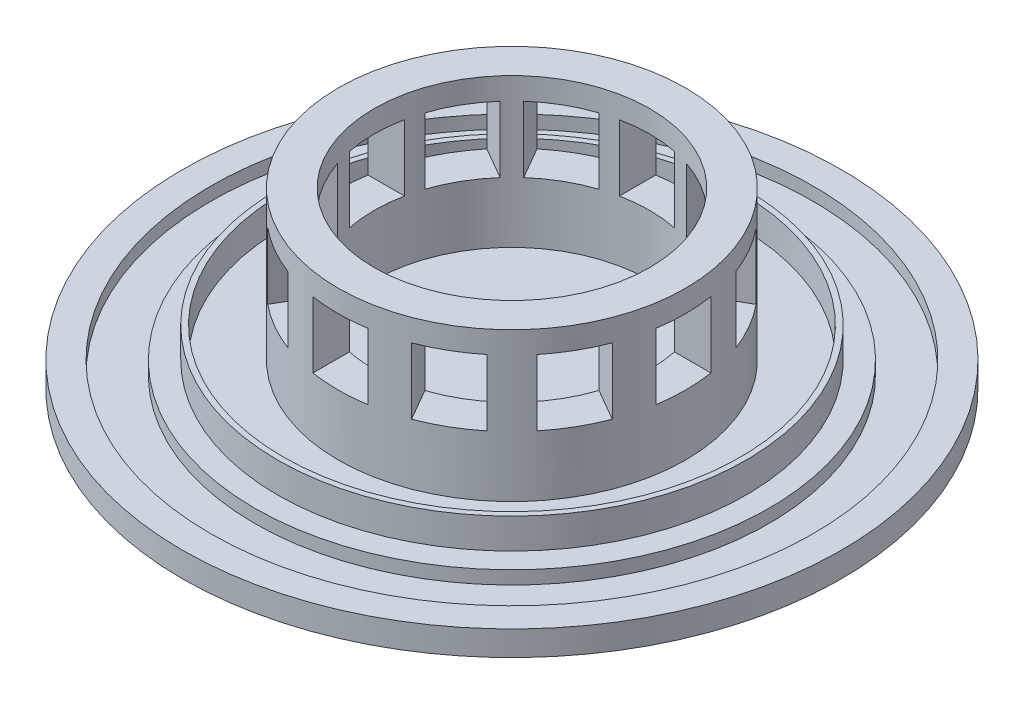
from build123d import *

# Parameters (mm, degrees)
SKETCH4_R           = 157.5
SKETCH4_R_2         = 125
BOSS_EXTRUDE1_DEPTH = 135
SKETCH5_W           = 50
SKETCH5_H           = 60
CUT_EXTRUDE1_DEPTH  = 447.397941427
CIRPATTERN1_COUNT   = 12


with BuildPart() as part:
    # Sketch3 → Revolve1 (revolve)
    with BuildSketch(Plane(origin=(0, 0, 0), x_dir=(0, 0, -1), z_dir=(1, 0, 0))):
        Polygon((-212.5, 8.070339729), (-212.5, 35.553232656), (-207.5, 35.553232656), (-207.5, 8.070339729), (0, 8.070339729), (0, -14.446767344), (-207.5, -14.446767344), (-299, -14.446767344), (-299, 8.070339729), (-273.25, 8.070339729), (-273.25, -3.929660271), (-233.25, -3.929660271), (-233.25, 8.070339729), align=None)
    revolve(axis=Axis((0, 120.738006406, 0), (0, -1, 0)))

    # Sketch4 → Boss-Extrude1 (add)
    with BuildSketch(Plane(origin=(0, 8.070339729, 0), x_dir=(1, 0, 0), z_dir=(0, 1, 0))):
        with Locations(Location((0, 0, 0), (0, 0, 270))):
            Circle(SKETCH4_R)
        with Locations(Location((0, 0, 0), (0, 0, 270))):
            Circle(SKETCH4_R_2, mode=Mode.SUBTRACT)
    extrude(amount=BOSS_EXTRUDE1_DEPTH)

    # Sketch5 → Cut-Extrude1 (cut, symmetric)
    with BuildSketch(Plane.XY):
        with Locations((0, 93.070339729)):
            Rectangle(SKETCH5_W, SKETCH5_H)
    cut_extrude1 = extrude(amount=CUT_EXTRUDE1_DEPTH, both=True, mode=Mode.SUBTRACT)

    # CirPattern1: Cut-Extrude1 ×12 about axis
    cirpattern1_axis = Axis((0, 0, 0), (0, 1, 0))
    for i in range(1, CIRPATTERN1_COUNT):
        add(cut_extrude1.rotate(cirpattern1_axis, i * 360 / CIRPATTERN1_COUNT), mode=Mode.SUBTRACT)


solid = part.part
